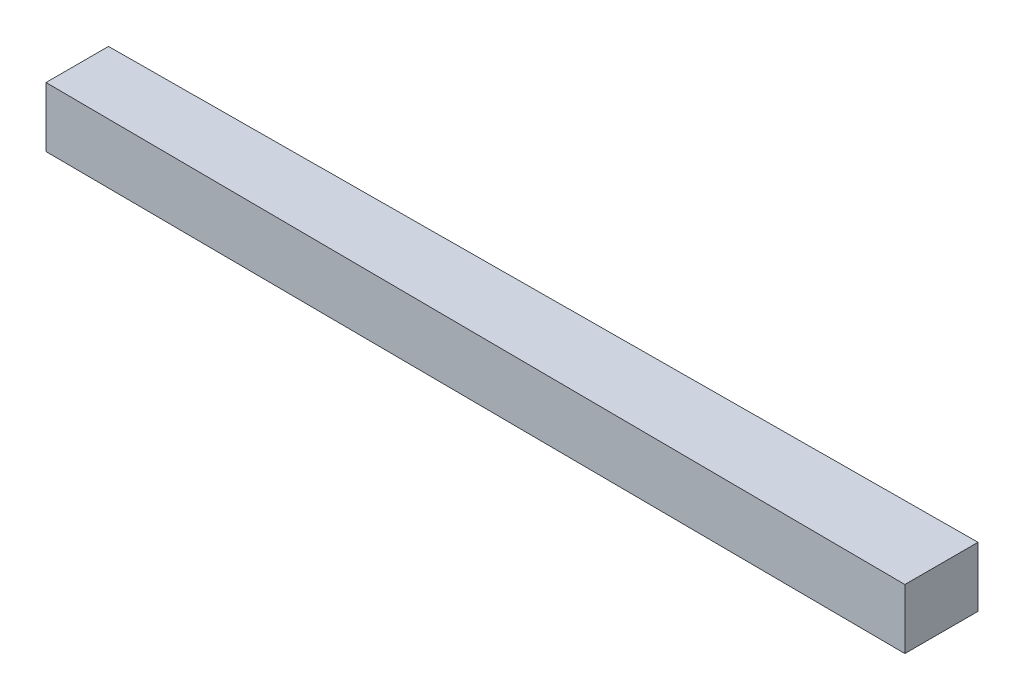
from build123d import *

# Parameters (mm, degrees)
BOSS_EXTRUDE1_DEPTH = 4.5


with BuildPart() as part:
    # Sketch1 → Boss-Extrude1 (new body)
    with BuildSketch(Plane(origin=(0, 0, 0), x_dir=(1, 0, 0), z_dir=(0, 1, 0))):
        Polygon((-32.5, -2.35), (-32.5, 2.35), (32.5, 2.75), (32.5, -2.75), align=None)
    extrude(amount=BOSS_EXTRUDE1_DEPTH)


solid = part.part
